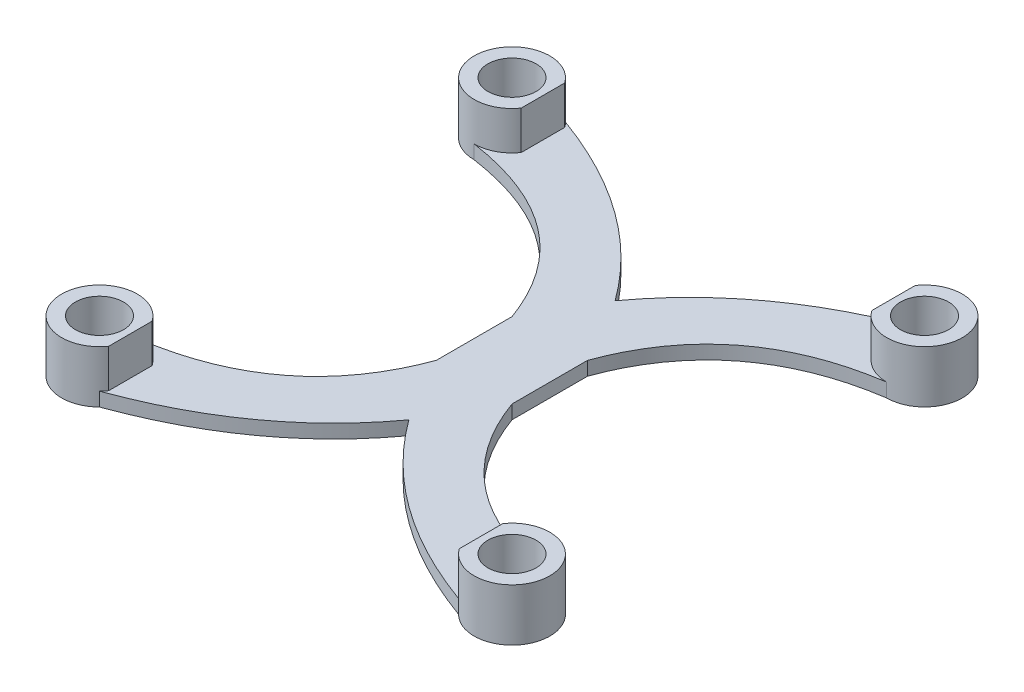
from build123d import *

# Parameters (mm, degrees)
SKETCH1_R           = 2.75
SKETCH1_R_2         = 1.75
SKETCH1_W           = 5.5
SKETCH1_H           = 5.5
BOSS_EXTRUDE1_DEPTH = 1
SKETCH2_R           = 2.75
SKETCH2_R_2         = 1.75
BOSS_EXTRUDE2_DEPTH = 2.8
SKETCH3_W           = 25.5
SKETCH3_H           = 35.5
CUT_EXTRUDE1_DEPTH  = 2.8


with BuildPart() as part:
    # Sketch1 → Boss-Extrude1 (new body)
    # profile 1 of 11: a face of its own
    with BuildSketch(Plane(origin=(0, 0, 0), x_dir=(1, 0, 0), z_dir=(0, 1, 0))):
        with Locations((-15, -15)):
            Circle(SKETCH1_R)
        with Locations(Location((-15, -15, 0), (0, 0, 270))):
            Circle(SKETCH1_R_2, mode=Mode.SUBTRACT)
    # profile 2 of 11: a face of its own
    with BuildSketch(Plane(origin=(0, 0, 0), x_dir=(1, 0, 0), z_dir=(0, 1, 0))):
        with BuildLine():
            add(Edge.make_bspline(
                [(0, -7.5), (-1.590584075, -5.319747163), (-2.75, -2.75)],
                knots=[0.745921805, 0.745921805, 0.745921805, 1, 1, 1], degree=2))
            add(Edge.make_bspline(
                [(-15, -12.25), (-5.706246464, -10.868692238), (-2.75, -2.75)],
                knots=[0, 0, 0, 1, 1, 1], degree=2))
            ThreePointArc((-15, -12.25), (-13.055456352, -13.055456352), (-12.25, -15))
            ThreePointArc((-12.25, -15), (-12.459331286, -16.052379439), (-13.055456352, -16.944543648))
            add(Edge.make_bspline(
                [(-13.055456352, -16.944543648), (-4.669630712, -13.900778032), (0, -7.5)],
                knots=[0, 0, 0, 0.745921805, 0.745921805, 0.745921805], degree=2))
        make_face()
    # profile 3 of 11: a face of its own
    with BuildSketch(Plane(origin=(0, 0, 0), x_dir=(1, 0, 0), z_dir=(0, 1, 0))):
        with BuildLine():
            add(Edge.make_bspline(
                [(0, -7.5), (1.590584075, -5.319747163), (2.75, -2.75)],
                knots=[0.745921805, 0.745921805, 0.745921805, 1, 1, 1], degree=2))
            Line((2.75, -2.75), (-2.75, -2.75))
            add(Edge.make_bspline(
                [(0, -7.5), (-1.590584075, -5.319747163), (-2.75, -2.75)],
                knots=[0.745921805, 0.745921805, 0.745921805, 1, 1, 1], degree=2))
        make_face()
    # profile 4 of 11: a face of its own
    with BuildSketch(Plane(origin=(0, 0, 0), x_dir=(1, 0, 0), z_dir=(0, 1, 0))):
        Rectangle(SKETCH1_W, SKETCH1_H)
    # profile 5 of 11: a face of its own
    with BuildSketch(Plane(origin=(0, 0, 0), x_dir=(1, 0, 0), z_dir=(0, 1, 0))):
        with BuildLine():
            add(Edge.make_bspline(
                [(15, -12.25), (5.706246464, -10.868692238), (2.75, -2.75)],
                knots=[0, 0, 0, 1, 1, 1], degree=2))
            add(Edge.make_bspline(
                [(0, -7.5), (1.590584075, -5.319747163), (2.75, -2.75)],
                knots=[0.745921805, 0.745921805, 0.745921805, 1, 1, 1], degree=2))
            add(Edge.make_bspline(
                [(13.055456352, -16.944543648), (4.669630712, -13.900778032), (0, -7.5)],
                knots=[0, 0, 0, 0.745921805, 0.745921805, 0.745921805], degree=2))
            ThreePointArc((13.055456352, -16.944543648), (12.459331286, -13.947620561), (15, -12.25))
        make_face()
    # profile 6 of 11: a face of its own
    with BuildSketch(Plane(origin=(0, 0, 0), x_dir=(1, 0, 0), z_dir=(0, 1, 0))):
        with Locations((15, -15)):
            Circle(SKETCH1_R)
        with Locations(Location((15, -15, 0), (0, 0, 270))):
            Circle(SKETCH1_R_2, mode=Mode.SUBTRACT)
    # profile 7 of 11: a face of its own
    with BuildSketch(Plane(origin=(0, 0, 0), x_dir=(1, 0, 0), z_dir=(0, 1, 0))):
        with BuildLine():
            add(Edge.make_bspline(
                [(0, 7.5), (1.590584075, 5.319747163), (2.75, 2.75)],
                knots=[0.745921805, 0.745921805, 0.745921805, 1, 1, 1], degree=2))
            add(Edge.make_bspline(
                [(15, 12.25), (5.706246464, 10.868692238), (2.75, 2.75)],
                knots=[0, 0, 0, 1, 1, 1], degree=2))
            ThreePointArc((15, 12.25), (12.459331286, 13.947620561), (13.055456352, 16.944543648))
            add(Edge.make_bspline(
                [(13.055456352, 16.944543648), (4.669630712, 13.900778032), (0, 7.5)],
                knots=[0, 0, 0, 0.745921805, 0.745921805, 0.745921805], degree=2))
        make_face()
    # profile 8 of 11: a face of its own
    with BuildSketch(Plane(origin=(0, 0, 0), x_dir=(1, 0, 0), z_dir=(0, 1, 0))):
        with Locations((15, 15)):
            Circle(SKETCH1_R)
        with Locations(Location((15, 15, 0), (0, 0, 270))):
            Circle(SKETCH1_R_2, mode=Mode.SUBTRACT)
    # profile 9 of 11: a face of its own
    with BuildSketch(Plane(origin=(0, 0, 0), x_dir=(1, 0, 0), z_dir=(0, 1, 0))):
        with BuildLine():
            Line((-2.75, 2.75), (2.75, 2.75))
            add(Edge.make_bspline(
                [(0, 7.5), (1.590584075, 5.319747163), (2.75, 2.75)],
                knots=[0.745921805, 0.745921805, 0.745921805, 1, 1, 1], degree=2))
            add(Edge.make_bspline(
                [(0, 7.5), (-1.590584075, 5.319747163), (-2.75, 2.75)],
                knots=[0.745921805, 0.745921805, 0.745921805, 1, 1, 1], degree=2))
        make_face()
    # profile 10 of 11: a face of its own
    with BuildSketch(Plane(origin=(0, 0, 0), x_dir=(1, 0, 0), z_dir=(0, 1, 0))):
        with BuildLine():
            add(Edge.make_bspline(
                [(-15, 12.25), (-5.706246464, 10.868692238), (-2.75, 2.75)],
                knots=[0, 0, 0, 1, 1, 1], degree=2))
            add(Edge.make_bspline(
                [(0, 7.5), (-1.590584075, 5.319747163), (-2.75, 2.75)],
                knots=[0.745921805, 0.745921805, 0.745921805, 1, 1, 1], degree=2))
            add(Edge.make_bspline(
                [(-13.055456352, 16.944543648), (-4.669630712, 13.900778032), (0, 7.5)],
                knots=[0, 0, 0, 0.745921805, 0.745921805, 0.745921805], degree=2))
            ThreePointArc((-13.055456352, 16.944543648), (-12.459331286, 16.052379439), (-12.25, 15))
            ThreePointArc((-12.25, 15), (-13.055456352, 13.055456352), (-15, 12.25))
        make_face()
    # profile 11 of 11: a face of its own
    with BuildSketch(Plane(origin=(0, 0, 0), x_dir=(1, 0, 0), z_dir=(0, 1, 0))):
        with Locations((-15, 15)):
            Circle(SKETCH1_R)
        with Locations(Location((-15, 15, 0), (0, 0, 270))):
            Circle(SKETCH1_R_2, mode=Mode.SUBTRACT)
    extrude(amount=BOSS_EXTRUDE1_DEPTH)

    # Sketch2 → Boss-Extrude2 (add)
    # profile 1 of 4: a face of its own
    with BuildSketch(Plane(origin=(0, 1, 0), x_dir=(1, 0, 0), z_dir=(0, 1, 0))):
        with Locations(Location((-15, 15, 0), (0, 0, 270))):
            Circle(SKETCH2_R)
        with Locations(Location((-15, 15, 0), (0, 0, 270))):
            Circle(SKETCH2_R_2, mode=Mode.SUBTRACT)
    # profile 2 of 4: a face of its own
    with BuildSketch(Plane(origin=(0, 1, 0), x_dir=(1, 0, 0), z_dir=(0, 1, 0))):
        with Locations(Location((15, 15, 0), (0, 0, 270))):
            Circle(SKETCH2_R)
        with Locations(Location((15, 15, 0), (0, 0, 270))):
            Circle(SKETCH2_R_2, mode=Mode.SUBTRACT)
    # profile 3 of 4: a face of its own
    with BuildSketch(Plane(origin=(0, 1, 0), x_dir=(1, 0, 0), z_dir=(0, 1, 0))):
        with Locations(Location((15, -15, 0), (0, 0, 90))):
            Circle(SKETCH2_R)
        with Locations(Location((15, -15, 0), (0, 0, 270))):
            Circle(SKETCH2_R_2, mode=Mode.SUBTRACT)
    # profile 4 of 4: a face of its own
    with BuildSketch(Plane(origin=(0, 1, 0), x_dir=(1, 0, 0), z_dir=(0, 1, 0))):
        with Locations(Location((-15, -15, 0), (0, 0, 90))):
            Circle(SKETCH2_R)
        with Locations(Location((-15, -15, 0), (0, 0, 270))):
            Circle(SKETCH2_R_2, mode=Mode.SUBTRACT)
    extrude(amount=BOSS_EXTRUDE2_DEPTH)

    # Sketch3 → Cut-Extrude1 (cut)
    with BuildSketch(Plane(origin=(0, 3.8, 0), x_dir=(1, 0, 0), z_dir=(0, 1, 0))):
        Rectangle(SKETCH3_W, SKETCH3_H)
    extrude(amount=-CUT_EXTRUDE1_DEPTH, mode=Mode.SUBTRACT)


solid = part.part
